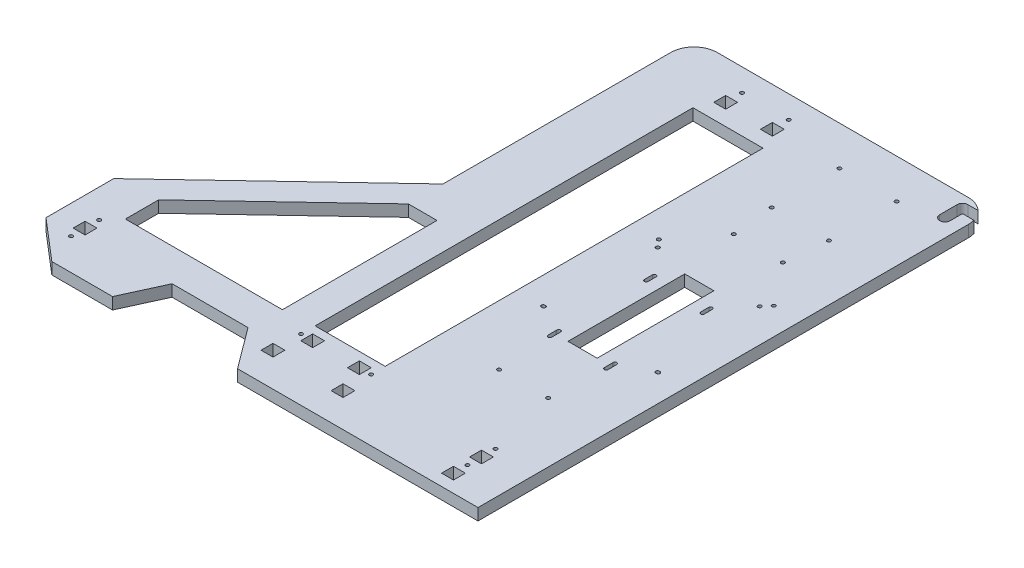
from build123d import *

# Parameters (mm, degrees)
BOSS_EXTRUDE1_DEPTH               = 10
SKETCH16_W                        = 20
SKETCH16_H                        = 440
BOSS_EXTRUDE2_DEPTH               = 10
SKETCH2_R                         = 1.55
SKETCH2_W                         = 60
SKETCH2_H                         = 323.65
SKETCH2_W_2                       = 10.2
SKETCH2_H_2                       = 10.2
CUT_EXTRUDE1_DEPTH                = 582.463670404
FILLET1_R                         = 20
SKETCH10_W                        = 25
SKETCH10_H                        = 100
WIRINGSLOT_DEPTH                  = 582.463670404
SKETCH6_R                         = 1.55
MOUNTINGHOLES_RAMPS_DEPTH         = 582.463670404
SKETCH5_R                         = 1.55
MOUNTINGHOLES_MELZI_DEPTH         = 582.463670404
SKETCH13_R                        = 1.55
MOUNTINGHOLES_SMOOTHIEBOARD_DEPTH = 582.463670404
SKETCH21_R                        = 1.55
PI_2_DEPTH                        = 582.463670404
CUT_EXTRUDE3_DEPTH                = 582.463670404
CUT_EXTRUDE4_DEPTH                = 582.463670404


with BuildPart() as part:
    # Sketch1 → Boss-Extrude1 (new body)
    with BuildSketch(Plane(origin=(0, 0, 0), x_dir=(1, 0, 0), z_dir=(0, 1, 0))):
        Polygon((0, 0), (-235, 0), (-235, -215), (-380, -352), (-380, -410), (-345, -440), (-293, -440), (-277, -405), (-212, -405), (-185.925501433, -440), (0, -440), align=None)
    extrude(amount=BOSS_EXTRUDE1_DEPTH)

    # Sketch16 → Boss-Extrude2 (add, through all)
    with BuildSketch(Plane(origin=(0, 10, 0), x_dir=(1, 0, 0), z_dir=(0, 1, 0))):
        with Locations((10, -220)):
            Rectangle(SKETCH16_W, SKETCH16_H)
    extrude(amount=-BOSS_EXTRUDE2_DEPTH)

    # Sketch2 → Cut-Extrude1 (cut, through all)
    with BuildSketch(Plane(origin=(0, 10, 0), x_dir=(1, 0, 0), z_dir=(0, 1, 0))):
        with Locations(Location((-16, -413, 0), (0, 0, 270))):
            Circle(SKETCH2_R)
        with Locations(Location((-16, -389, 0), (0, 0, 270))):
            Circle(SKETCH2_R)
        with Locations(Location((-355.55, -413, 0), (0, 0, 270))):
            Circle(SKETCH2_R)
        with Locations(Location((-355.55, -389, 0), (0, 0, 270))):
            Circle(SKETCH2_R)
        with Locations(Location((-174.5, -19.35, 0), (0, 0, 270))):
            Circle(SKETCH2_R)
        with Locations(Location((-134.5, -19.35, 0), (0, 0, 90))):
            Circle(SKETCH2_R)
        with Locations(Location((-124.5, -387.1, 0), (0, 0, 270))):
            Circle(SKETCH2_R)
        with Locations(Location((-184.5, -387.1, 0), (0, 0, 90))):
            Circle(SKETCH2_R)
        Polygon((-345, -348.509746257), (-235, -244.578711775), (-210.5, -244.578711775), (-210.5, -377), (-345, -377), align=None)
        with Locations((-154.5, -213.175)):
            Rectangle(SKETCH2_W, SKETCH2_H)
        with Locations((-16, -425)):
            Rectangle(SKETCH2_W_2, SKETCH2_H_2)
        with Locations((-16, -401)):
            Rectangle(SKETCH2_W_2, SKETCH2_H_2)
        with Locations((-355.55, -401)):
            Rectangle(SKETCH2_W_2, SKETCH2_H_2)
        with Locations((-174.5, -33.35)):
            Rectangle(SKETCH2_W_2, SKETCH2_H_2)
        with Locations((-134.5, -33.35)):
            Rectangle(SKETCH2_W_2, SKETCH2_H_2)
        with Locations((-174.5, -387.1)):
            Rectangle(SKETCH2_W_2, SKETCH2_H_2)
        with Locations((-134.5, -387.1)):
            Rectangle(SKETCH2_W_2, SKETCH2_H_2)
        with Locations((-184.5, -411.1)):
            Rectangle(SKETCH2_W_2, SKETCH2_H_2)
        with Locations((-124.5, -411.1)):
            Rectangle(SKETCH2_W_2, SKETCH2_H_2)
    extrude(amount=-CUT_EXTRUDE1_DEPTH, mode=Mode.SUBTRACT)

    # Fillet1
    fillet1_edges = [part.edges().sort_by_distance(p)[0] for p in [
        (-235, 5, 0),
        (20, 5, 0),
    ]]
    fillet(fillet1_edges, radius=FILLET1_R)

    # Sketch10 → WiringSlot (cut, through all)
    with BuildSketch(Plane(origin=(0, 10, 0), x_dir=(1, 0, 0), z_dir=(0, 1, 0))):
        with Locations((-52.25, -228.175)):
            Rectangle(SKETCH10_W, SKETCH10_H)
    extrude(amount=-WIRINGSLOT_DEPTH, mode=Mode.SUBTRACT)

    # Sketch6 → MountingHoles-RAMPS (cut, through all)
    with BuildSketch(Plane(origin=(0, 10, 0), x_dir=(1, 0, 0), z_dir=(0, 1, 0))):
        with Locations(Location((-76.35, -274.475, 0), (0, 0, 90))):
            Circle(SKETCH6_R)
        with Locations(Location((-76.35, -199.575, 0), (0, 0, 90))):
            Circle(SKETCH6_R)
        with BuildLine():
            Line((-26.6, -192.575), (-26.6, -199.575))
            ThreePointArc((-26.6, -199.575), (-28.15, -201.125), (-29.7, -199.575))
            Line((-29.7, -199.575), (-29.7, -192.575))
            ThreePointArc((-29.7, -192.575), (-28.15, -191.025), (-26.6, -192.575))
        make_face()
        with BuildLine():
            Line((-29.7, -282.075), (-29.7, -275.075))
            ThreePointArc((-29.7, -275.075), (-28.15, -273.525), (-26.6, -275.075))
            Line((-26.6, -275.075), (-26.6, -282.075))
            ThreePointArc((-26.6, -282.075), (-28.15, -283.625), (-29.7, -282.075))
        make_face()
    mountingholes_ramps = extrude(amount=-MOUNTINGHOLES_RAMPS_DEPTH, mode=Mode.SUBTRACT)

    # Mirror1: MountingHoles-RAMPS across plane
    add(mountingholes_ramps.mirror(Plane(origin=(-52.25, 0, 0), x_dir=(0, 0, 1), z_dir=(1, 0, 0))), mode=Mode.SUBTRACT)

    # Sketch5 → MountingHoles-Melzi (cut, through all)
    with BuildSketch(Plane(origin=(0, 10, 0), x_dir=(1, 0, 0), z_dir=(0, 1, 0))):
        with Locations(Location((-73.25, -127.675, 0), (0, 0, 270))):
            Circle(SKETCH5_R)
        with Locations(Location((-31.25, -127.675, 0), (0, 0, 90))):
            Circle(SKETCH5_R)
        with Locations(Location((-31.25, -328.675, 0), (0, 0, 270))):
            Circle(SKETCH5_R)
        with Locations(Location((-73.25, -328.675, 0), (0, 0, 90))):
            Circle(SKETCH5_R)
    extrude(amount=-MOUNTINGHOLES_MELZI_DEPTH, mode=Mode.SUBTRACT)

    # Sketch13 → Mountingholes-Smoothieboard (cut, through all)
    with BuildSketch(Plane(origin=(0, 0, 0), x_dir=(-1, 0, 0), z_dir=(0, -1, 0))):
        with Locations(Location((101.46, -163.66, 0), (0, 0, 90))):
            Circle(SKETCH13_R)
        with Locations(Location((101.46, -262.69, 0), (0, 0, 270))):
            Circle(SKETCH13_R)
        with Locations(Location((8.62, -170.14, 0), (0, 0, 90))):
            Circle(SKETCH13_R)
        with Locations(Location((3.56, -262.69, 0), (0, 0, 90))):
            Circle(SKETCH13_R)
    mountingholes_smoothieboard = extrude(amount=-MOUNTINGHOLES_SMOOTHIEBOARD_DEPTH, mode=Mode.SUBTRACT)

    # Flipped: Mountingholes-Smoothieboard across plane
    add(mountingholes_smoothieboard.mirror(Plane(origin=(-52.25, 0, 0), x_dir=(0, 0, 1), z_dir=(1, 0, 0))), mode=Mode.SUBTRACT)

    # Sketch21 → Pi 2 (cut, through all)
    with BuildSketch(Plane(origin=(0, 10, 0), x_dir=(1, 0, 0), z_dir=(0, 1, 0))):
        with Locations(Location((-27.75, -33.675, 0), (0, 0, 270))):
            Circle(SKETCH21_R)
        with Locations(Location((-76.75, -33.675, 0), (0, 0, 90))):
            Circle(SKETCH21_R)
        with Locations(Location((-76.75, -91.675, 0), (0, 0, 270))):
            Circle(SKETCH21_R)
        with Locations(Location((-27.75, -91.675, 0), (0, 0, 90))):
            Circle(SKETCH21_R)
    extrude(amount=-PI_2_DEPTH, mode=Mode.SUBTRACT)

    # Sketch17 → Cut-Extrude3 (cut, through all)
    with BuildSketch(Plane(origin=(0, 10, 0), x_dir=(1, 0, 0), z_dir=(0, 1, 0))):
        with BuildLine():
            Line((20, -14.5), (5, -14.5))
            ThreePointArc((5, -14.5), (0.5, -10), (5, -5.5))
            Line((5, -5.5), (20, -5.5))
            ThreePointArc((20, -5.5), (24.5, -10), (20, -14.5))
        make_face()
    extrude(amount=-CUT_EXTRUDE3_DEPTH, mode=Mode.SUBTRACT)

    # Sketch18 → Cut-Extrude4 (cut, through all)
    with BuildSketch(Plane(origin=(0, 10, 0), x_dir=(1, 0, 0), z_dir=(0, 1, 0))):
        with BuildLine():
            Line((9.5, -10), (9.5, -25))
            ThreePointArc((9.5, -25), (5, -29.5), (0.5, -25))
            Line((0.5, -25), (0.5, -10))
            ThreePointArc((0.5, -10), (5, -5.5), (9.5, -10))
        make_face()
    extrude(amount=-CUT_EXTRUDE4_DEPTH, mode=Mode.SUBTRACT)


solid = part.part
